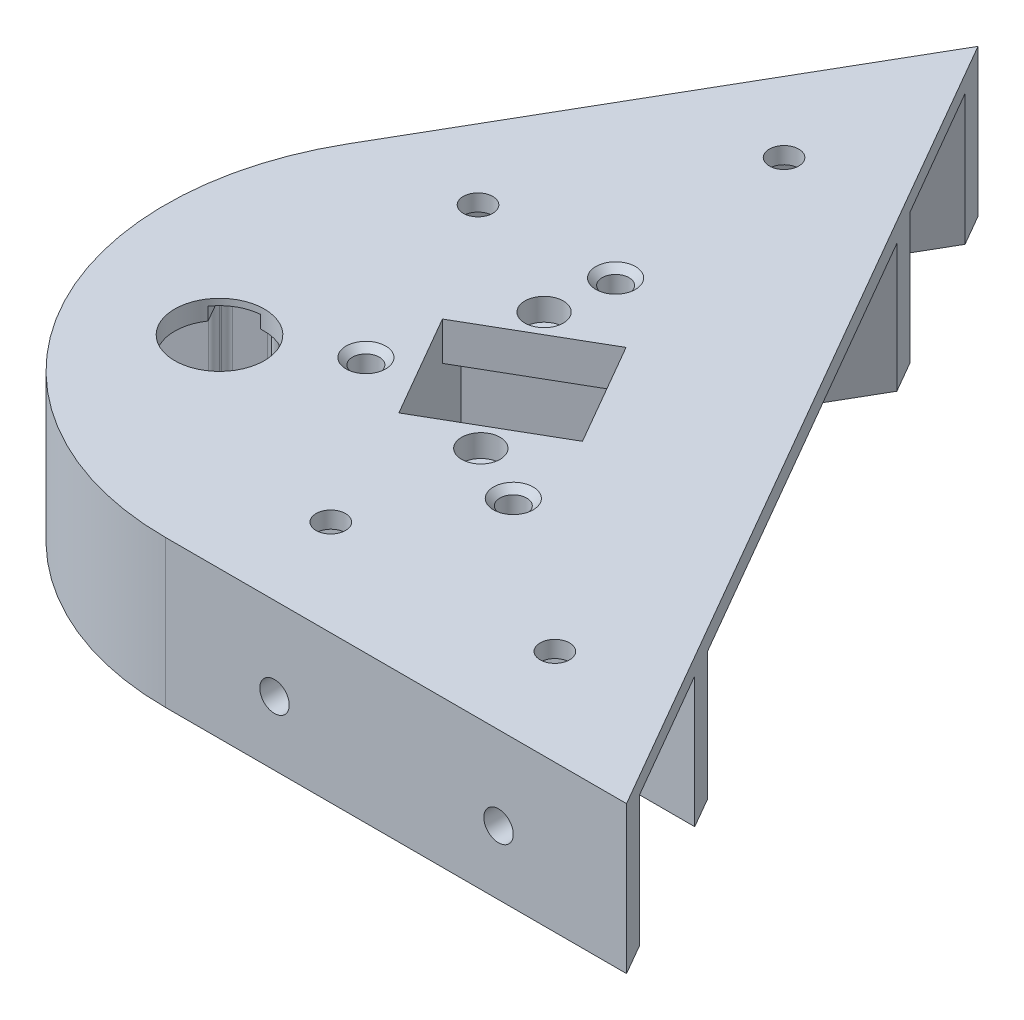
from build123d import *

# Parameters (mm, degrees)
BOSS_EXTRUDE1_DEPTH      = 23
SKETCH2_W                = 100.4
SKETCH2_H                = 20.4
CUT_EXTRUDE2_DEPTH       = 20.4
CUT_EXTRUDE3_DEPTH       = 20
SKETCH7_R                = 2.3
CUT_EXTRUDE6_DEPTH       = 10
SKETCH8_R                = 2.3
CUT_EXTRUDE7_DEPTH       = 10
FILLET3_R                = 45
CUT_EXTRUDE11_DEPTH      = 200.759855827
CUT_EXTRUDE11_DEPTH_BACK = 200.759855827
CUT_EXTRUDE10_DEPTH      = 20
SKETCH32_R               = 2.3
CUT_EXTRUDE18_DEPTH      = 10
SKETCH33_R               = 2.3
CUT_EXTRUDE19_DEPTH      = 10
SKETCH34_R               = 2.3
CUT_EXTRUDE20_DEPTH      = 149.465956609
SKETCH35_R               = 4
CUT_EXTRUDE21_DEPTH      = 152.333845776
SKETCH36_R               = 2.1
CUT_EXTRUDE22_DEPTH      = 200.759855838
SKETCH38_R               = 2.3
CUT_EXTRUDE24_DEPTH      = 10
BOSS_EXTRUDE2_DEPTH      = 6
SKETCH40_R               = 1.65
CUT_EXTRUDE25_DEPTH      = 200.158228561
SKETCH41_R               = 3
CUT_EXTRUDE26_DEPTH      = 3.5
SKETCH42_R               = 2.1
CUT_EXTRUDE27_DEPTH      = 200.759855838
CHAMFER2_SIZE            = 1
SKETCH43_R               = 2.1
CUT_EXTRUDE28_DEPTH      = 15
CHAMFER3_SIZE            = 1
SKETCH45_R               = 2.3
CUT_EXTRUDE29_DEPTH      = 130.123625221
SKETCH46_R               = 4
CUT_EXTRUDE30_DEPTH      = 127.307236488
SKETCH47_R               = 7
CUT_EXTRUDE31_DEPTH      = 10
CUT_EXTRUDE32_DEPTH      = 20
CUT_EXTRUDE32_DEPTH_BACK = 2
FILLET4_R                = 1


with BuildPart() as part:
    # Sketch1 → Boss-Extrude1 (new body)
    with BuildSketch(Plane(origin=(0, 0, 0), x_dir=(1, 0, 0), z_dir=(0, 1, 0))):
        Polygon((0, 0), (150, 0), (75, 129.903810568), align=None)
    extrude(amount=BOSS_EXTRUDE1_DEPTH)

    # Sketch2 → Cut-Extrude2 (cut)
    with BuildSketch(Plane(origin=(0, 0, 0), x_dir=(1, 0, 0), z_dir=(0, 1, 0))):
        Polygon((108.923840175, 138.261625339), (58.723840175, 51.312674799), (41.056921938, 61.512674799), (91.256921938, 148.461625339), align=None)
        with Locations((124, 15)):
            Rectangle(SKETCH2_W, SKETCH2_H)
    extrude(amount=CUT_EXTRUDE2_DEPTH, mode=Mode.SUBTRACT)

    # Sketch4 → Cut-Extrude3 (cut)
    with BuildSketch(Plane(origin=(0, 0, 0), x_dir=(1, 0, 0), z_dir=(0, 1, 0))):
        Polygon((58.515583945, 45.561933634), (40.848665708, 35.361933634), (51.048665708, 17.695015397), (68.715583945, 27.895015397), align=None)
    extrude(amount=CUT_EXTRUDE3_DEPTH, mode=Mode.SUBTRACT)

    # Sketch7 → Cut-Extrude6 (cut)
    with BuildSketch(Plane(origin=(0, 0, 0), x_dir=(-0.4999999999999978, 0, 0.86602540378444), z_dir=(-0.86602540378444, 0, -0.4999999999999978))):
        with Locations((-130, 10)):
            Circle(SKETCH7_R)
        with Locations((-95, 10)):
            Circle(SKETCH7_R)
    extrude(amount=-CUT_EXTRUDE6_DEPTH, mode=Mode.SUBTRACT)

    # Sketch8 → Cut-Extrude7 (cut)
    with BuildSketch(Plane.XY):
        with Locations((130, 10)):
            Circle(SKETCH8_R)
        with Locations((95, 10)):
            Circle(SKETCH8_R)
    extrude(amount=-CUT_EXTRUDE7_DEPTH, mode=Mode.SUBTRACT)

    # Fillet3
    fillet3_edges = [part.edges().sort_by_distance(p)[0] for p in [
        (0, 11.5, 0),
    ]]
    fillet(fillet3_edges, radius=FILLET3_R)

    # Sketch22 → Cut-Extrude11 (cut, two sides: drawn at the far end of the back side and taken through both)
    with BuildSketch(Plane.XZ.offset(-CUT_EXTRUDE11_DEPTH_BACK)):
        Polygon((83.35335133, -28.147760515), (66.05335133, -58.112239485), (84.23988481, -68.612239485), (101.53988481, -38.647760515), align=None)
    extrude(amount=CUT_EXTRUDE11_DEPTH + CUT_EXTRUDE11_DEPTH_BACK, mode=Mode.SUBTRACT)

    # Sketch21 → Cut-Extrude10 (cut)
    with BuildSketch(Plane.XZ):
        Polygon((132.679491924, -30), (109.996773286, -30), (80.979148757, -80.26), (92.320508076, -99.903810568), align=None)
    extrude(amount=-CUT_EXTRUDE10_DEPTH, mode=Mode.SUBTRACT)

    # Sketch32 → Cut-Extrude18 (cut)
    with BuildSketch(Plane(origin=(0, 0, -30), x_dir=(-1, 0, 0), z_dir=(0, 0, -1))):
        with Locations((-121.338132605, 10)):
            Circle(SKETCH32_R)
    extrude(amount=-CUT_EXTRUDE18_DEPTH, mode=Mode.SUBTRACT)

    # Sketch33 → Cut-Extrude19 (cut)
    with BuildSketch(Plane(origin=(25.980762114, 0, 15), x_dir=(0.4999999999999997, 0, -0.8660254037844388), z_dir=(0.8660254037844389, 0, 0.49999999999999983))):
        with Locations((121.338132605, 10)):
            Circle(SKETCH33_R)
    extrude(amount=-CUT_EXTRUDE19_DEPTH, mode=Mode.SUBTRACT)

    # Sketch34 → Cut-Extrude20 (cut, through all)
    with BuildSketch(Plane(origin=(45.948665708, 0, -26.528474516), x_dir=(-0.5000000000000001, 0, -0.8660254037844386), z_dir=(0.8660254037844386, 0, -0.5000000000000001))):
        with Locations((0, 10)):
            Circle(SKETCH34_R)
    extrude(amount=-CUT_EXTRUDE20_DEPTH, mode=Mode.SUBTRACT)

    # Sketch35 → Cut-Extrude21 (cut, through all)
    with BuildSketch(Plane(origin=(43.350589497, 0, -25.028474516), x_dir=(-0.5000000000000001, 0, -0.8660254037844386), z_dir=(0.8660254037844386, 0, -0.5000000000000001))):
        with Locations((0, 10)):
            Circle(SKETCH35_R)
    extrude(amount=-CUT_EXTRUDE21_DEPTH, mode=Mode.SUBTRACT)

    # Sketch36 → Cut-Extrude22 (cut, through all)
    with BuildSketch(Plane(origin=(0, 23, 0), x_dir=(1, 0, 0), z_dir=(0, 1, 0))):
        with Locations(Location((69.282032303, 40, 0), (0, 0, 270))):
            Circle(SKETCH36_R)
    extrude(amount=-CUT_EXTRUDE22_DEPTH, mode=Mode.SUBTRACT)

    # Sketch38 → Cut-Extrude24 (cut)
    with BuildSketch(Plane.XZ.offset(-20.4)):
        with Locations(Location((88.8, -15, 0), (0, 0, 270))):
            Circle(SKETCH38_R)
        with Locations(Location((123.8, -15, 0), (0, 0, 270))):
            Circle(SKETCH38_R)
        with Locations(Location((57.390381057, -69.403055856, 0), (0, 0, 270))):
            Circle(SKETCH38_R)
        with Locations(Location((74.890381057, -99.713944989, 0), (0, 0, 270))):
            Circle(SKETCH38_R)
    extrude(amount=-CUT_EXTRUDE24_DEPTH, mode=Mode.SUBTRACT)

    # Sketch39 → Boss-Extrude2 (add)
    with BuildSketch(Plane(origin=(0, 23, 0), x_dir=(1, 0, 0), z_dir=(0, 1, 0))):
        Polygon((66.05335133, 58.112239485), (84.23988481, 68.612239485), (88.23988481, 61.684036255), (70.05335133, 51.184036255), align=None)
        Polygon((101.53988481, 38.647760515), (83.35335133, 28.147760515), (79.35335133, 35.075963745), (97.53988481, 45.575963745), align=None)
    extrude(amount=-BOSS_EXTRUDE2_DEPTH)

    # Sketch40 → Cut-Extrude25 (cut, through all)
    with BuildSketch(Plane.XZ.offset(-17)):
        with Locations(Location((90.54661807, -36.688657049, 0), (0, 0, 270))):
            Circle(SKETCH40_R)
        with Locations(Location((77.04661807, -60.071342951, 0), (0, 0, 270))):
            Circle(SKETCH40_R)
    extrude(amount=-CUT_EXTRUDE25_DEPTH, mode=Mode.SUBTRACT)

    # Sketch41 → Cut-Extrude26 (cut)
    with BuildSketch(Plane(origin=(0, 23, 0), x_dir=(1, 0, 0), z_dir=(0, 1, 0))):
        with Locations(Location((77.04661807, 60.071342951, 0), (0, 0, 270))):
            Circle(SKETCH41_R)
        with Locations(Location((90.54661807, 36.688657049, 0), (0, 0, 270))):
            Circle(SKETCH41_R)
    extrude(amount=-CUT_EXTRUDE26_DEPTH, mode=Mode.SUBTRACT)

    # Sketch42 → Cut-Extrude27 (cut, through all)
    with BuildSketch(Plane(origin=(0, 23, 0), x_dir=(1, 0, 0), z_dir=(0, 1, 0))):
        with Locations(Location((99.860934211, 32.446784409, 0), (0, 0, 270))):
            Circle(SKETCH42_R)
        with Locations(Location((78.030206675, 70.258713668, 0), (0, 0, 270))):
            Circle(SKETCH42_R)
    extrude(amount=-CUT_EXTRUDE27_DEPTH, mode=Mode.SUBTRACT)

    # Chamfer2
    chamfer2_edges = [part.edges().sort_by_distance(p)[0] for p in [
        (69.282032303, 23, -42.1),
        (99.860934211, 23, -34.546784409),
        (78.030206675, 23, -72.358713668),
    ]]
    chamfer(chamfer2_edges, length=CHAMFER2_SIZE)

    # Sketch43 → Cut-Extrude28 (cut)
    with BuildSketch(Plane.XZ):
        with Locations(Location((64.382124827, -15.000786763, 0), (0, 0, 270))):
            Circle(SKETCH43_R)
        with Locations(Location((45.182124827, -48.256162268, 0), (0, 0, 270))):
            Circle(SKETCH43_R)
    extrude(amount=-CUT_EXTRUDE28_DEPTH, mode=Mode.SUBTRACT)

    # Chamfer3
    chamfer3_edges = [part.edges().sort_by_distance(p)[0] for p in [
        (64.382124827, 0, -12.900786763),
        (45.182124827, 0, -46.156162268),
    ]]
    chamfer(chamfer3_edges, length=CHAMFER3_SIZE)

    # Sketch45 → Cut-Extrude29 (cut, through all)
    with BuildSketch(Plane(origin=(63.615583945, 0, -36.728474516), x_dir=(0.5, 0, 0.8660254037844386), z_dir=(-0.8660254037844387, 0, 0.5000000000000001))):
        with Locations(Location((0, 10, 0), (0, 0, 180))):
            Circle(SKETCH45_R)
    extrude(amount=-CUT_EXTRUDE29_DEPTH, mode=Mode.SUBTRACT)

    # Sketch46 → Cut-Extrude30 (cut, through all)
    with BuildSketch(Plane(origin=(66.213660157, 0, -38.228474516), x_dir=(0.5, 0, 0.8660254037844386), z_dir=(-0.8660254037844387, 0, 0.5000000000000001))):
        with Locations(Location((0, 10, 0), (0, 0, 180))):
            Circle(SKETCH46_R)
    extrude(amount=-CUT_EXTRUDE30_DEPTH, mode=Mode.SUBTRACT)

    # Sketch47 → Cut-Extrude31 (cut)
    with BuildSketch(Plane.XZ.offset(-20)):
        with Locations(Location((54.782124827, -31.628474516, 0), (0, 0, 270))):
            Circle(SKETCH47_R)
    extrude(amount=-CUT_EXTRUDE31_DEPTH, mode=Mode.SUBTRACT)

    # Sketch48 → Cut-Extrude32 (cut, two sides: drawn at the far end of the back side and taken through both)
    with BuildSketch(Plane.XZ.offset(-20).offset(-CUT_EXTRUDE32_DEPTH_BACK)):
        Polygon((58.684048615, -18.870144266), (45.684048615, -41.386804765), (50.880201038, -44.386804765), (63.880201038, -21.870144266), align=None)
    extrude(amount=CUT_EXTRUDE32_DEPTH + CUT_EXTRUDE32_DEPTH_BACK, mode=Mode.SUBTRACT)

    # Fillet4
    fillet4_edges = [part.edges().sort_by_distance(p)[0] for p in [
        (62.480201038, 10, -24.295015397),
        (52.280201038, 10, -41.961933634),
        (63.880201038, 11, -21.870144266),
        (47.084048615, 10, -38.961933634),
        (57.284048615, 10, -21.295015397),
        (45.684048615, 11, -41.386804765),
        (58.684048615, 11, -18.870144266),
        (50.880201038, 11, -44.386804765),
    ]]
    fillet(fillet4_edges, radius=FILLET4_R)


solid = part.part
